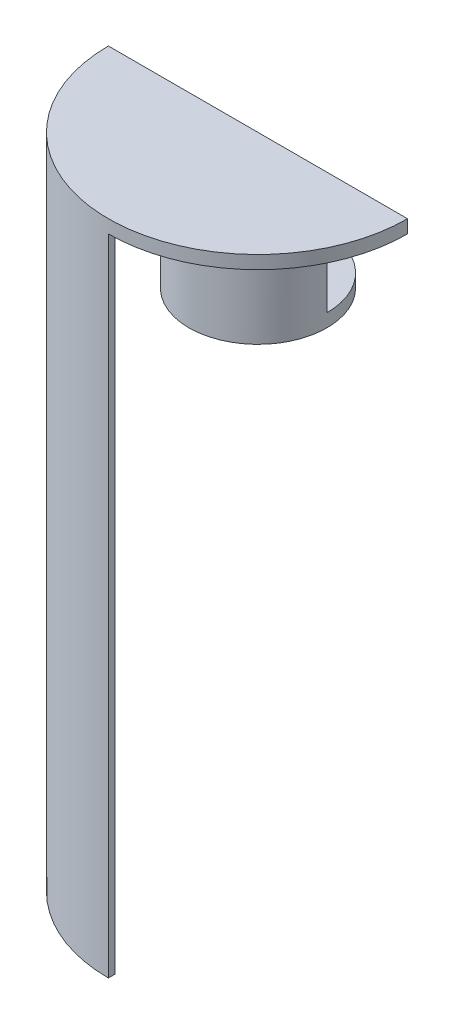
from build123d import *

# Parameters (mm, degrees)
CROQUIS1_R              = 43.5
CROQUIS1_R_2            = 30
SALIENTE_EXTRUIR1_DEPTH = 4
CROQUIS2_R              = 30
CROQUIS2_R_2            = 20
SALIENTE_EXTRUIR2_DEPTH = 4
CROQUIS3_R              = 30
CROQUIS3_R_2            = 20
CORTAR_EXTRUIR1_DEPTH   = 2
CROQUIS5_R              = 3
CORTAR_EXTRUIR3_DEPTH   = 4
SALIENTE_EXTRUIR3_DEPTH = 200
CROQUIS8_R              = 45.5
SALIENTE_EXTRUIR4_DEPTH = 4
CROQUIS9_R              = 21
CROQUIS9_R_2            = 19
SALIENTE_EXTRUIR5_DEPTH = 33
CORTAR_EXTRUIR6_START   = -33
CORTAR_EXTRUIR6_DEPTH   = 33
CROQUIS11_R             = 21
SALIENTE_EXTRUIR6_DEPTH = 4
CORTAR_EXTRUIR7_START   = -4
CORTAR_EXTRUIR7_DEPTH   = 4
CROQUIS14_R             = 45.5
CORTAR_EXTRUIR9_DEPTH   = 4
CORTAR_EXTRUIR11_DEPTH  = 200
CROQUIS16_R             = 10
CORTAR_EXTRUIR12_DEPTH  = 4
CORTAR_EXTRUIR13_START  = 200
CORTAR_EXTRUIR13_DEPTH  = 4


with BuildPart() as part:
    # Croquis1 → Saliente-Extruir1 (new body)
    with BuildSketch(Plane(origin=(0, 0, 0), x_dir=(1, 0, 0), z_dir=(0, 1, 0))):
        with Locations(Location((0, 0, 0), (0, 0, 270))):
            Circle(CROQUIS1_R)
        with Locations(Location((0, 0, 0), (0, 0, 270))):
            Circle(CROQUIS1_R_2, mode=Mode.SUBTRACT)
    extrude(amount=SALIENTE_EXTRUIR1_DEPTH)

    # Croquis2 → Saliente-Extruir2 (add)
    with BuildSketch(Plane(origin=(0, 0, 0), x_dir=(1, 0, 0), z_dir=(0, 1, 0))):
        Circle(CROQUIS2_R)
        with Locations(Location((0, 0, 0), (0, 0, 270))):
            Circle(CROQUIS2_R_2, mode=Mode.SUBTRACT)
    extrude(amount=SALIENTE_EXTRUIR2_DEPTH)

    # Croquis3 → Cortar-Extruir1 (cut)
    with BuildSketch(Plane(origin=(0, 0, 0), x_dir=(1, 0, 0), z_dir=(0, 1, 0))):
        with Locations(Location((0, 0, 0), (0, 0, 270))):
            Circle(CROQUIS3_R)
        with Locations(Location((0, 0, 0), (0, 0, 270))):
            Circle(CROQUIS3_R_2, mode=Mode.SUBTRACT)
    extrude(amount=CORTAR_EXTRUIR1_DEPTH, mode=Mode.SUBTRACT)

    # Croquis5 → Cortar-Extruir3 (cut)
    with BuildSketch(Plane(origin=(0, 0, 0), x_dir=(1, 0, 0), z_dir=(0, 1, 0))):
        with Locations(Location((0, -37.5, 0), (0, 0, 270))):
            Circle(CROQUIS5_R)
        with Locations(Location((-37.5, 0, 0), (0, 0, 270))):
            Circle(CROQUIS5_R)
        with Locations(Location((0, 37.5, 0), (0, 0, 270))):
            Circle(CROQUIS5_R)
        with Locations(Location((37.5, 0, 0), (0, 0, 270))):
            Circle(CROQUIS5_R)
    extrude(amount=CORTAR_EXTRUIR3_DEPTH, mode=Mode.SUBTRACT)

    # Croquis7 → Saliente-Extruir3 (add)
    with BuildSketch(Plane(origin=(0, 0, 0), x_dir=(1, 0, 0), z_dir=(0, 1, 0))):
        with BuildLine():
            Line((-45.5, 0), (-43.5, 0))
            ThreePointArc((-43.5, 0), (0, -43.5), (43.5, 0))
            Line((43.5, 0), (45.5, 0))
            ThreePointArc((45.5, 0), (0, -45.5), (-45.5, 0))
        make_face()
    extrude(amount=SALIENTE_EXTRUIR3_DEPTH)

    # Croquis8 → Saliente-Extruir4 (add)
    with BuildSketch(Plane(origin=(0, 200, 0), x_dir=(1, 0, 0), z_dir=(0, 1, 0))):
        Circle(CROQUIS8_R)
    extrude(amount=SALIENTE_EXTRUIR4_DEPTH)

    # Croquis9 → Saliente-Extruir5 (add)
    with BuildSketch(Plane.XZ.offset(-200)):
        with Locations(Location((0, 0, 0), (0, 0, 90))):
            Circle(CROQUIS9_R)
        with Locations(Location((0, 0, 0), (0, 0, 270))):
            Circle(CROQUIS9_R_2, mode=Mode.SUBTRACT)
    extrude(amount=SALIENTE_EXTRUIR5_DEPTH)

    # Croquis10 → Cortar-Extruir6 (cut)
    with BuildSketch(Plane.XZ.offset(-167).offset(CORTAR_EXTRUIR6_START)):
        with BuildLine():
            Line((21, 0), (-21, 0))
            ThreePointArc((-21, 0), (0, -21), (21, 0))
        make_face()
    extrude(amount=CORTAR_EXTRUIR6_DEPTH, mode=Mode.SUBTRACT)

    # Croquis11 → Saliente-Extruir6 (add)
    with BuildSketch(Plane.XZ.offset(-167)):
        with Locations(Location((0, 0, 0), (0, 0, 180))):
            Circle(CROQUIS11_R)
    extrude(amount=SALIENTE_EXTRUIR6_DEPTH)

    # Croquis12 → Cortar-Extruir7 (cut)
    with BuildSketch(Plane.XZ.offset(-163).offset(CORTAR_EXTRUIR7_START)):
        with BuildLine():
            Line((-3, 0), (-3, -20.784609691))
            ThreePointArc((-3, -20.784609691), (0, -21), (3, -20.784609691))
            Line((3, -20.784609691), (3, 0))
            ThreePointArc((3, 0), (0, 3), (-3, 0))
        make_face()
    extrude(amount=CORTAR_EXTRUIR7_DEPTH, mode=Mode.SUBTRACT)

    # Croquis14 → Cortar-Extruir9 (cut)
    with BuildSketch(Plane.XZ):
        Circle(CROQUIS14_R)
    extrude(amount=-CORTAR_EXTRUIR9_DEPTH, mode=Mode.SUBTRACT)

    # Croquis15 → Cortar-Extruir11 (cut)
    with BuildSketch(Plane(origin=(0, 0, 0), x_dir=(1, 0, 0), z_dir=(0, 1, 0))):
        with BuildLine():
            Line((43.5, 0), (45.5, 0))
            ThreePointArc((45.5, 0), (32.173358544, -32.173358544), (0, -45.5))
            Line((0, -45.5), (0, -43.5))
            ThreePointArc((0, -43.5), (30.759144982, -30.759144982), (43.5, 0))
        make_face()
    extrude(amount=CORTAR_EXTRUIR11_DEPTH, mode=Mode.SUBTRACT)

    # Croquis16 → Cortar-Extruir12 (cut)
    with BuildSketch(Plane.XZ.offset(-163)):
        Circle(CROQUIS16_R)
    extrude(amount=-CORTAR_EXTRUIR12_DEPTH, mode=Mode.SUBTRACT)

    # Croquis17 → Cortar-Extruir13 (cut)
    with BuildSketch(Plane(origin=(0, 0, 0), x_dir=(1, 0, 0), z_dir=(0, 1, 0)).offset(CORTAR_EXTRUIR13_START)):
        with BuildLine():
            Line((-45.5, 0), (45.5, 0))
            ThreePointArc((45.5, 0), (0, 45.5), (-45.5, 0))
        make_face()
    extrude(amount=CORTAR_EXTRUIR13_DEPTH, mode=Mode.SUBTRACT)


solid = part.part
